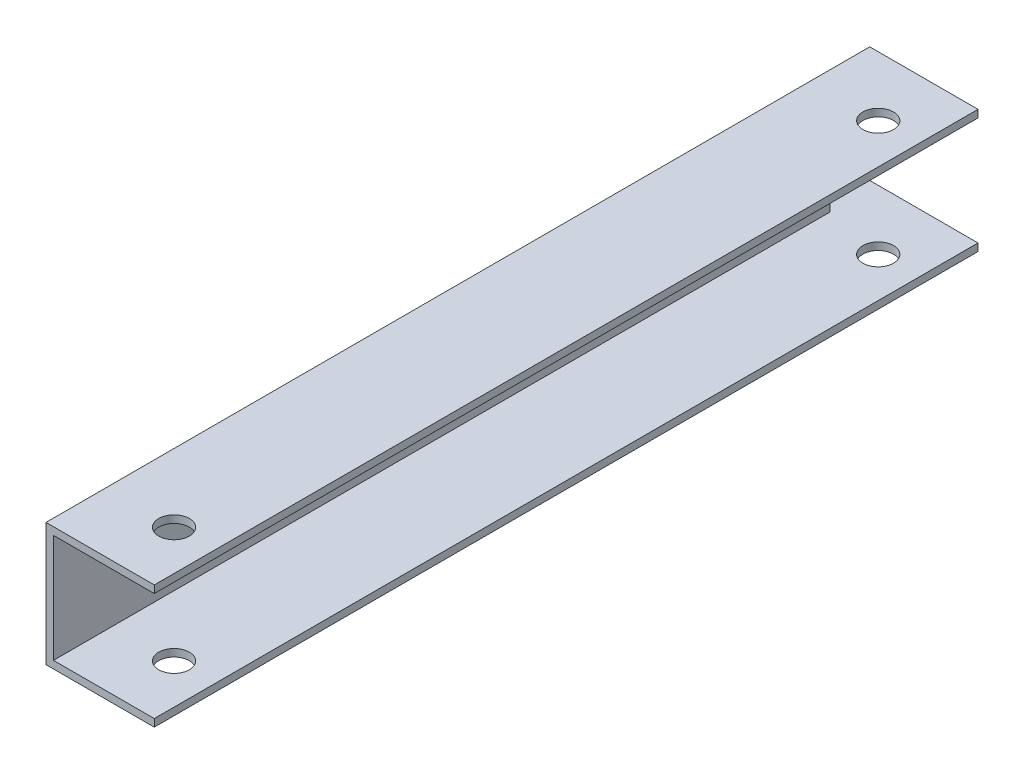
from build123d import *

# Parameters (mm, degrees)
SALIENTE_EXTRUIR1_DEPTH = 175
CROQUIS2_R              = 6.5
CORTAR_EXTRUIR1_DEPTH   = 300
CROQUIS3_W              = 20
CROQUIS3_H              = 46
CORTAR_EXTRUIR2_DEPTH   = 10


with BuildPart() as part:
    # Croquis1 → Saliente-Extruir1 (new, symmetric)
    with BuildSketch(Plane.XY):
        Polygon((23, 23), (-19.825, 23), (-19.825, -23), (23, -23), (23, -26.175), (-23, -26.175), (-23, 26.175), (23, 26.175), align=None)
    extrude(amount=SALIENTE_EXTRUIR1_DEPTH, both=True)

    # Croquis2 → Cortar-Extruir1 (cut)
    with BuildSketch(Plane.XZ.offset(26.175)):
        with Locations(Location((6, 149.6, 0), (0, 0, 90))):
            Circle(CROQUIS2_R)
        with Locations(Location((6, -149.6, 0), (0, 0, 90))):
            Circle(CROQUIS2_R)
    extrude(amount=-CORTAR_EXTRUIR1_DEPTH, mode=Mode.SUBTRACT)

    # Croquis3 → Cortar-Extruir2 (cut)
    with BuildSketch(Plane.ZY.offset(23)):
        with Locations((-165, 0)):
            Rectangle(CROQUIS3_W, CROQUIS3_H)
    extrude(amount=-CORTAR_EXTRUIR2_DEPTH, mode=Mode.SUBTRACT)


solid = part.part
